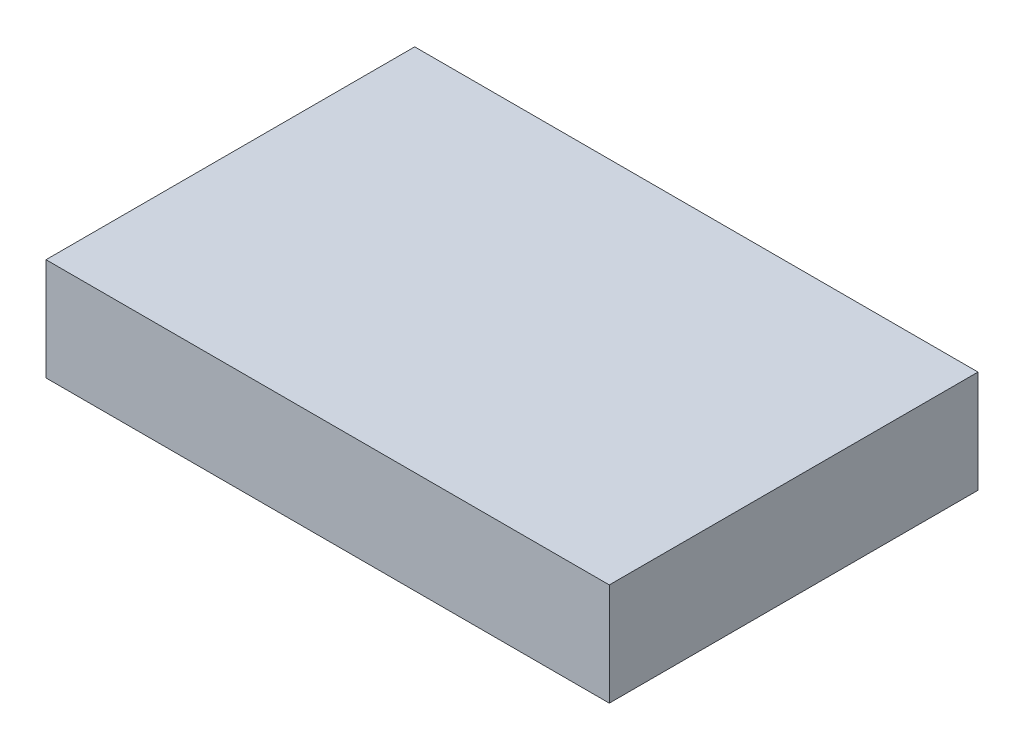
from build123d import *

# Parameters (mm, degrees)
SKETCH1_W           = 110
SKETCH1_H           = 72
BOSS_EXTRUDE1_DEPTH = 20


with BuildPart() as part:
    # Sketch1 → Boss-Extrude1 (new body)
    with BuildSketch(Plane(origin=(0, 0, 0), x_dir=(1, 0, 0), z_dir=(0, 1, 0))):
        Rectangle(SKETCH1_W, SKETCH1_H)
    extrude(amount=BOSS_EXTRUDE1_DEPTH)


solid = part.part
